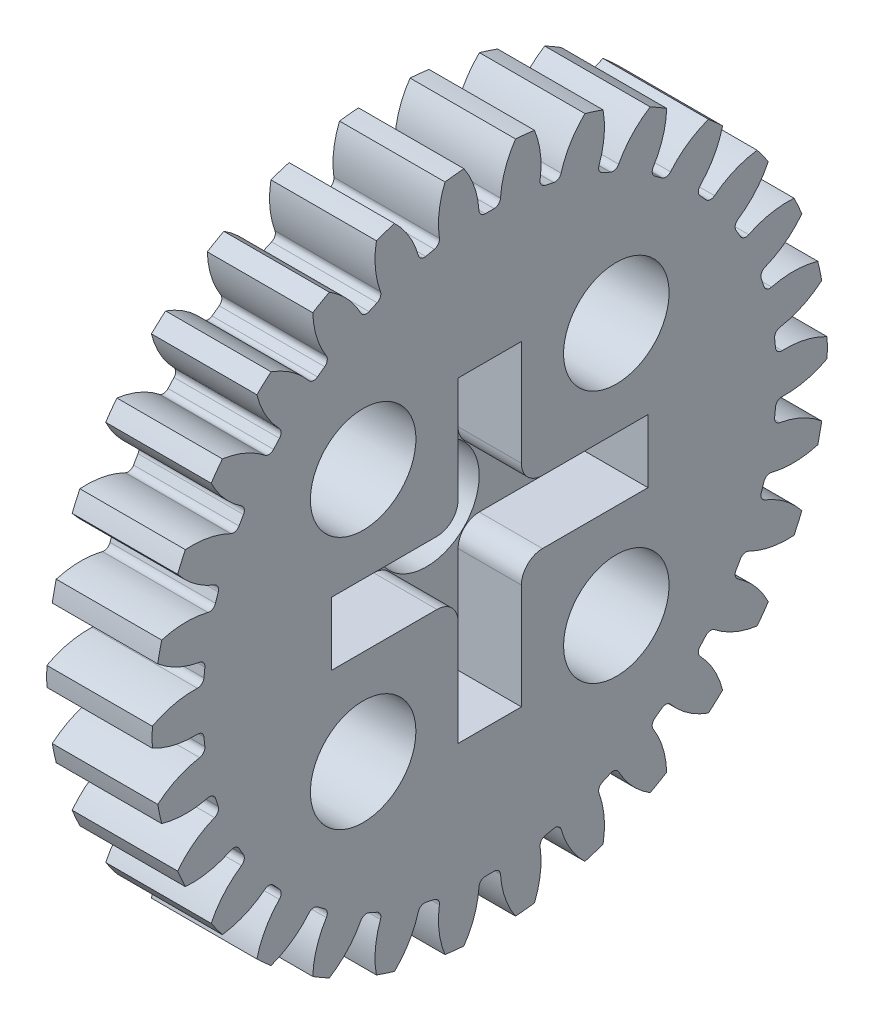
from build123d import *

# Parameters (mm, degrees)
SKETCH1_R           = 16
BOSS_EXTRUDE1_DEPTH = 5
CUT_EXTRUDE1_DEPTH  = 24.173260453
CIRPATTERN1_COUNT   = 30
CUT_EXTRUDE2_DEPTH  = 3
FILLET1_R           = 1
SKETCH5_R           = 2.5
CUT_EXTRUDE3_DEPTH  = 24.141002082


with BuildPart() as part:
    # Sketch1 → Boss-Extrude1 (new body)
    with BuildSketch(Plane(origin=(0, 0, 0), x_dir=(0, 0, -1), z_dir=(1, 0, 0))):
        Circle(SKETCH1_R)
    extrude(amount=BOSS_EXTRUDE1_DEPTH)

    # Sketch2 → Cut-Extrude1 (cut, through all)
    with BuildSketch(Plane(origin=(5, 0, 0), x_dir=(0, 0, -1), z_dir=(1, 0, 0))):
        with BuildLine():
            Line((-0.210023287, 13.6), (0.210023287, 13.6))
            ThreePointArc((0.210023287, 13.6), (0.414953438, 13.680902686), (0.509354258, 13.879975779))
            ThreePointArc((0.509354258, 13.879975779), (0.978481181, 15.545530493), (2.08, 16.88))
            ThreePointArc((2.08, 16.88), (0, 17.000581665), (-2.08, 16.88))
            ThreePointArc((-2.08, 16.88), (-0.978481181, 15.545530493), (-0.509354258, 13.879975779))
            ThreePointArc((-0.509354258, 13.879975779), (-0.414953438, 13.680902686), (-0.210023287, 13.6))
        make_face()
    cut_extrude1 = extrude(amount=-CUT_EXTRUDE1_DEPTH, mode=Mode.SUBTRACT)

    # CirPattern1: Cut-Extrude1 ×30 about axis
    cirpattern1_axis = Axis((0, 0, 0), (1, 0, 0))
    for i in range(1, CIRPATTERN1_COUNT):
        add(cut_extrude1.rotate(cirpattern1_axis, i * 360 / CIRPATTERN1_COUNT), mode=Mode.SUBTRACT)

    # Sketch4 → Cut-Extrude2 (cut)
    with BuildSketch(Plane(origin=(5, 0, 0), x_dir=(0, 0, -1), z_dir=(1, 0, 0))):
        Polygon((-1.5, 7.5), (1.5, 7.5), (1.5, 1.5), (7.5, 1.5), (7.5, -1.5), (1.5, -1.5), (1.5, -7.5), (-1.5, -7.5), (-1.5, -1.5), (-7.5, -1.5), (-7.5, 1.5), (-1.5, 1.5), align=None)
    extrude(amount=-CUT_EXTRUDE2_DEPTH, mode=Mode.SUBTRACT)

    # Fillet1
    fillet1_edges = [part.edges().sort_by_distance(p)[0] for p in [
        (3.5, 1.5, 1.5),
        (3.5, 1.5, -1.5),
        (3.5, -1.5, -1.5),
        (3.5, -1.5, 1.5),
    ]]
    fillet(fillet1_edges, radius=FILLET1_R)

    # Sketch5 → Cut-Extrude3 (cut, through all)
    with BuildSketch(Plane(origin=(5, 0, 0), x_dir=(0, 0, -1), z_dir=(1, 0, 0))):
        with Locations((6, 6)):
            Circle(SKETCH5_R)
        with Locations(Location((6, -6, 0), (0, 0, 180))):
            Circle(SKETCH5_R)
        with Locations(Location((-6, 6, 0), (0, 0, 180))):
            Circle(SKETCH5_R)
        with Locations((-6, -6)):
            Circle(SKETCH5_R)
        Circle(SKETCH5_R)
    extrude(amount=-CUT_EXTRUDE3_DEPTH, mode=Mode.SUBTRACT)


solid = part.part
